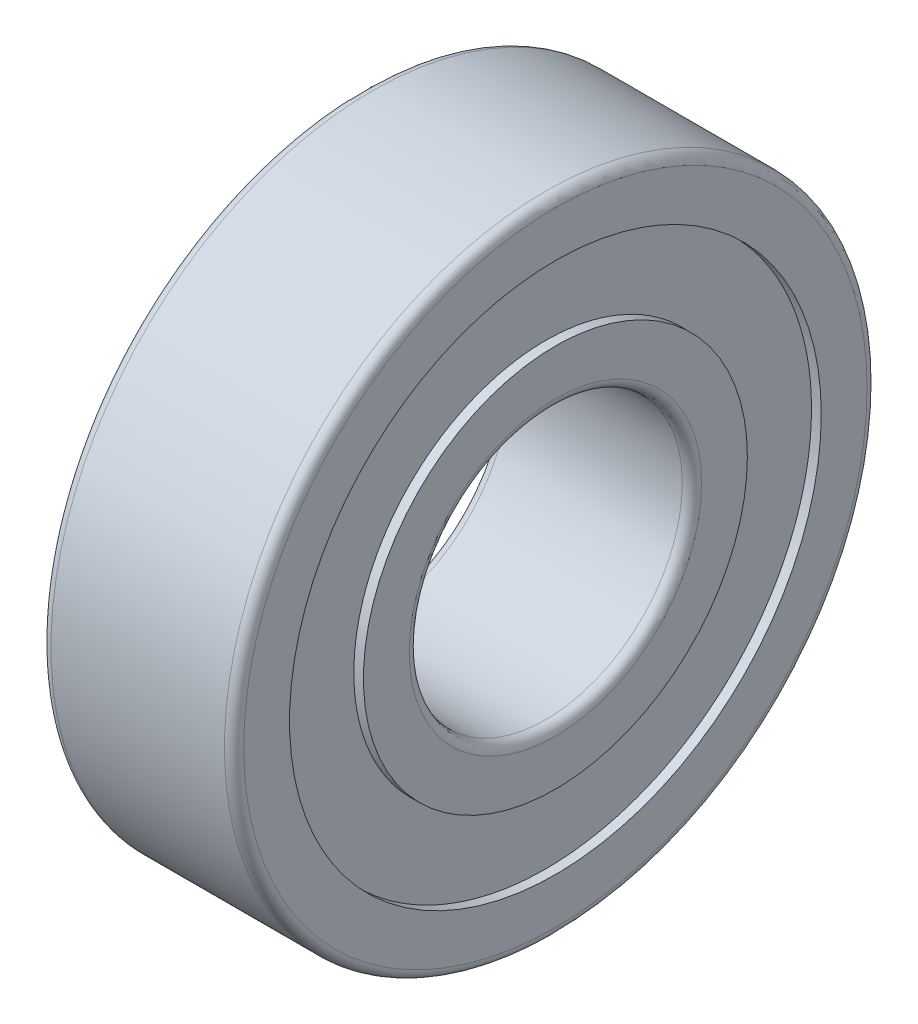
from build123d import *

# Parameters (mm, degrees)
R_P_TITION_CIRCULAIRE1_COUNT = 10
ESQUISSE1_W                  = 0.6
ESQUISSE1_H                  = 4.6
ESQUISSE2_W                  = 0.6
ESQUISSE2_H                  = 4.6


with BuildPart() as part:
    # BalDetSke → BallDetailed (revolve)
    with BuildSketch(Plane.XY):
        with BuildLine():
            Line((-3.45, 14.25), (3.45, 14.25))
            ThreePointArc((3.45, 14.25), (0, 10.8), (-3.45, 14.25))
        make_face()
    revolve(axis=Axis((-1.905, 14.25, 0), (1, 0, 0)))


with BuildPart() as body_2:
    # InnRacSke → InnerRace (revolve)
    with BuildSketch(Plane.XY, mode=Mode.PRIVATE) as innerrace_sk:
        with BuildLine():
            Line((-2.537838647, 11.95), (-6, 11.95))
            Line((-6, 11.95), (-6, 9.1))
            ThreePointArc((-6, 9.1), (-5.824264069, 8.675735931), (-5.4, 8.5))
            Line((-5.4, 8.5), (5.4, 8.5))
            ThreePointArc((5.4, 8.5), (5.824264069, 8.675735931), (6, 9.1))
            Line((6, 9.1), (6, 11.95))
            Line((6, 11.95), (2.537838647, 11.95))
            ThreePointArc((2.537838647, 11.95), (0, 10.825), (-2.537838647, 11.95))
        make_face()
    revolve(innerrace_sk.sketch.rotate(Axis((-20.6375, 0, 0), (1, 0, 0)), 270), axis=Axis((-20.6375, 0, 0), (1, 0, 0)))


with BuildPart() as body_3:
    # OutRacSke → OuterRace (revolve)
    with BuildSketch(Plane.XY, mode=Mode.PRIVATE) as outerrace_sk:
        with BuildLine():
            Line((-2.537838647, 16.55), (-6, 16.55))
            Line((-6, 16.55), (-6, 19.4))
            ThreePointArc((-6, 19.4), (-5.824264069, 19.824264069), (-5.4, 20))
            Line((-5.4, 20), (5.4, 20))
            ThreePointArc((5.4, 20), (5.824264069, 19.824264069), (6, 19.4))
            Line((6, 19.4), (6, 16.55))
            Line((6, 16.55), (2.537838647, 16.55))
            ThreePointArc((2.537838647, 16.55), (0, 17.675), (-2.537838647, 16.55))
        make_face()
    revolve(outerrace_sk.sketch.rotate(Axis((-20.6375, 0, 0), (1, 0, 0)), 270), axis=Axis((-20.6375, 0, 0), (1, 0, 0)))


with BuildPart() as r_p_tition_circulaire1_1:
    # Répétition circulaire1: pattern copy
    add(part.part.rotate(Axis((0, 0, 0), (1, 0, 0)), 1 * 360 / R_P_TITION_CIRCULAIRE1_COUNT))


with BuildPart() as r_p_tition_circulaire1_2:
    # Répétition circulaire1: pattern copy
    add(part.part.rotate(Axis((0, 0, 0), (1, 0, 0)), 2 * 360 / R_P_TITION_CIRCULAIRE1_COUNT))


with BuildPart() as r_p_tition_circulaire1_3:
    # Répétition circulaire1: pattern copy
    add(part.part.rotate(Axis((0, 0, 0), (1, 0, 0)), 3 * 360 / R_P_TITION_CIRCULAIRE1_COUNT))


with BuildPart() as r_p_tition_circulaire1_4:
    # Répétition circulaire1: pattern copy
    add(part.part.rotate(Axis((0, 0, 0), (1, 0, 0)), 4 * 360 / R_P_TITION_CIRCULAIRE1_COUNT))


with BuildPart() as r_p_tition_circulaire1_5:
    # Répétition circulaire1: pattern copy
    add(part.part.rotate(Axis((0, 0, 0), (1, 0, 0)), 5 * 360 / R_P_TITION_CIRCULAIRE1_COUNT))


with BuildPart() as r_p_tition_circulaire1_6:
    # Répétition circulaire1: pattern copy
    add(part.part.rotate(Axis((0, 0, 0), (1, 0, 0)), 6 * 360 / R_P_TITION_CIRCULAIRE1_COUNT))


with BuildPart() as r_p_tition_circulaire1_7:
    # Répétition circulaire1: pattern copy
    add(part.part.rotate(Axis((0, 0, 0), (1, 0, 0)), 7 * 360 / R_P_TITION_CIRCULAIRE1_COUNT))


with BuildPart() as r_p_tition_circulaire1_8:
    # Répétition circulaire1: pattern copy
    add(part.part.rotate(Axis((0, 0, 0), (1, 0, 0)), 8 * 360 / R_P_TITION_CIRCULAIRE1_COUNT))


with BuildPart() as r_p_tition_circulaire1_9:
    # Répétition circulaire1: pattern copy
    add(part.part.rotate(Axis((0, 0, 0), (1, 0, 0)), 9 * 360 / R_P_TITION_CIRCULAIRE1_COUNT))


with BuildPart() as body_13:
    # Esquisse1 → Révol.-Mince3 (revolve)
    with BuildSketch(Plane.XY, mode=Mode.PRIVATE) as r_vol_mince3_sk:
        with Locations((5.1, 14.25)):
            Rectangle(ESQUISSE1_W, ESQUISSE1_H)
    revolve(r_vol_mince3_sk.sketch.rotate(Axis((-20.6375, 0, 0), (1, 0, 0)), 90), axis=Axis((-20.6375, 0, 0), (1, 0, 0)))


with BuildPart() as body_14:
    # Esquisse2 → Révol.-Mince5 (revolve)
    with BuildSketch(Plane.XY, mode=Mode.PRIVATE) as r_vol_mince5_sk:
        with Locations((-5.1, 14.25)):
            Rectangle(ESQUISSE2_W, ESQUISSE2_H)
    revolve(r_vol_mince5_sk.sketch.rotate(Axis((-20.6375, 0, 0), (1, 0, 0)), 90), axis=Axis((-20.6375, 0, 0), (1, 0, 0)))


solid = Compound([part.part, body_2.part, body_3.part, r_p_tition_circulaire1_1.part, r_p_tition_circulaire1_2.part, r_p_tition_circulaire1_3.part, r_p_tition_circulaire1_4.part, r_p_tition_circulaire1_5.part, r_p_tition_circulaire1_6.part, r_p_tition_circulaire1_7.part, r_p_tition_circulaire1_8.part, r_p_tition_circulaire1_9.part, body_13.part, body_14.part])
